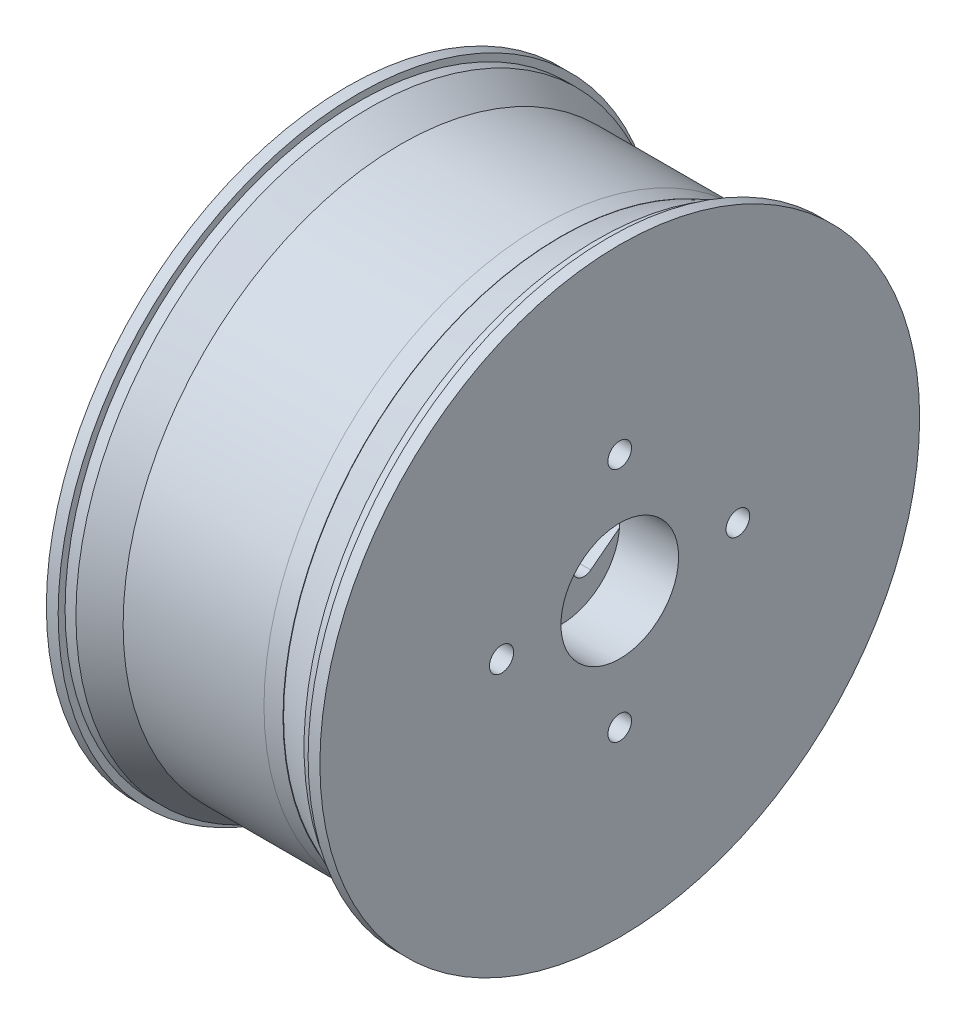
from build123d import *

# Parameters (mm, degrees)
CROQUIS2_R                 = 5
CORTAR_EXTRUIR1_DEPTH      = 225.951634778
ESCALA1_SCALE              = 0.8
CORTAR_EXTRUIR2_DEPTH      = 255
CORTAR_EXTRUIR2_DEPTH_BACK = 175
CROQUIS3_W                 = 69.878792472
CROQUIS3_H                 = 224.605431487
CROQUIS5_R                 = 101.510629677
CORTAR_EXTRUIR3_DEPTH      = 1.8
CROQUIS6_R                 = 19.91659092
CORTAR_EXTRUIR4_DEPTH      = 123
CROQUIS7_R                 = 4
CROQUIS7_R_2               = 4.0947051
CORTAR_EXTRUIR5_DEPTH      = 123


with BuildPart() as part:
    # Croquis1 → Revolución1 (revolve)
    with BuildSketch(Plane(origin=(0, 0, 0), x_dir=(1, 0, 0), z_dir=(0, 1, 0)), mode=Mode.PRIVATE) as revoluci_n1_sk:
        Polygon((-84.492307697, 126.907004271), (-84.492307697, 121.907004271), (-77.199679771, 118.257622684), (-61.599944947, 112.544039646), (-54.839043525, 112.544039646), (-54.839043525, 24.920091933), (-36.545776531, 24.920091933), (-36.545776531, 112.544088846), (57.615236657, 112.544088846), (73.214966765, 118.25768476), (80.50759168, 121.907072367), (80.507587553, 126.907072367), (75.507587548, 126.912704348), (75.507589968, 123.980963434), (70.922334115, 123.980959649), (57.615232714, 117.321797618), (-1.992356117, 117.321748418), (-61.599944947, 117.321748418), (-74.907051844, 123.980899465), (-79.492307697, 123.980899465), (-79.492307697, 126.912640379), align=None)
    revolve(revoluci_n1_sk.sketch.rotate(Axis((-84.492307697, 0, 0.092995729), (1, 0, 0)), 180), axis=Axis((-84.492307697, 0, 0.092995729), (1, 0, 0)))

    # Croquis2 → Cortar-Extruir1 (cut, through all)
    with BuildSketch(Plane.ZY.offset(54.839043525)):
        with BuildLine():
            ThreePointArc((30.528582788, -45.440133008), (25.150332276, -46.880047701), (24.664698483, -52.426496358))
            Line((24.664698483, -52.426496358), (34.516411599, -69.490164015))
            ThreePointArc((34.516411599, -69.490164015), (38.954270135, -71.910965134), (43.137091963, -69.072150594))
            Line((43.137091963, -69.072150594), (53.742727711, -55.310992442))
            ThreePointArc((53.742727711, -55.310992442), (54.305907236, -50.480348559), (50.307859812, -47.711249735))
            Line((50.307859812, -47.711249735), (30.528582788, -45.440133008))
        make_face()
        with BuildLine():
            ThreePointArc((45.440133008, 30.528582788), (46.880047701, 25.150332276), (52.426496358, 24.664698483))
            Line((52.426496358, 24.664698483), (69.490164015, 34.516411599))
            ThreePointArc((69.490164015, 34.516411599), (71.910965134, 38.954270135), (69.072150594, 43.137091963))
            Line((69.072150594, 43.137091963), (55.310992442, 53.742727711))
            ThreePointArc((55.310992442, 53.742727711), (50.480348559, 54.305907236), (47.711249735, 50.307859812))
            Line((47.711249735, 50.307859812), (45.440133008, 30.528582788))
        make_face()
        with BuildLine():
            ThreePointArc((-45.440133008, -30.528582788), (-46.880047701, -25.150332276), (-52.426496358, -24.664698483))
            Line((-52.426496358, -24.664698483), (-69.490164015, -34.516411599))
            ThreePointArc((-69.490164015, -34.516411599), (-71.910965134, -38.954270135), (-69.072150594, -43.137091963))
            Line((-69.072150594, -43.137091963), (-55.310992442, -53.742727711))
            ThreePointArc((-55.310992442, -53.742727711), (-50.480348559, -54.305907236), (-47.711249735, -50.307859812))
            Line((-47.711249735, -50.307859812), (-45.440133008, -30.528582788))
        make_face()
        with BuildLine():
            ThreePointArc((-30.528582788, 45.440133008), (-25.150332276, 46.880047701), (-24.664698483, 52.426496358))
            Line((-24.664698483, 52.426496358), (-34.516411599, 69.490164015))
            ThreePointArc((-34.516411599, 69.490164015), (-38.954270135, 71.910965134), (-43.137091963, 69.072150594))
            Line((-43.137091963, 69.072150594), (-53.742727711, 55.310992442))
            ThreePointArc((-53.742727711, 55.310992442), (-54.305907236, 50.480348559), (-50.307859812, 47.711249735))
            Line((-50.307859812, 47.711249735), (-30.528582788, 45.440133008))
        make_face()
        with BuildLine():
            Line((-100.841208128, 17.107848943), (-102.748469547, 0.497407258))
            ThreePointArc((-102.748469547, 0.497407258), (-98.913930395, -4.33194641), (-94.084576727, -0.497407258))
            Line((-94.084576727, -0.497407258), (-92.177315309, 16.113034427))
            ThreePointArc((-92.177315309, 16.113034427), (-96.011854461, 20.942388095), (-100.841208128, 17.107848943))
        make_face()
        with BuildLine():
            Line((17.107848943, 100.841208128), (0.497407258, 102.748469547))
            ThreePointArc((0.497407258, 102.748469547), (-4.33194641, 98.913930395), (-0.497407258, 94.084576727))
            Line((-0.497407258, 94.084576727), (16.113034427, 92.177315309))
            ThreePointArc((16.113034427, 92.177315309), (20.942388095, 96.011854461), (17.107848943, 100.841208128))
        make_face()
        with BuildLine():
            Line((100.841208128, -17.107848943), (102.748469547, -0.497407258))
            ThreePointArc((102.748469547, -0.497407258), (98.913930395, 4.33194641), (94.084576727, 0.497407258))
            Line((94.084576727, 0.497407258), (92.177315309, -16.113034427))
            ThreePointArc((92.177315309, -16.113034427), (96.011854461, -20.942388095), (100.841208128, -17.107848943))
        make_face()
        with BuildLine():
            Line((-17.107848943, -100.841208128), (-0.497407258, -102.748469547))
            ThreePointArc((-0.497407258, -102.748469547), (4.33194641, -98.913930395), (0.497407258, -94.084576727))
            Line((0.497407258, -94.084576727), (-16.113034427, -92.177315309))
            ThreePointArc((-16.113034427, -92.177315309), (-20.942388095, -96.011854461), (-17.107848943, -100.841208128))
        make_face()
        with Locations((50, 0)):
            Circle(CROQUIS2_R)
        with Locations((0, -50)):
            Circle(CROQUIS2_R)
        with Locations((-50, 0)):
            Circle(CROQUIS2_R)
        with Locations((0, 50)):
            Circle(CROQUIS2_R)
    extrude(amount=-CORTAR_EXTRUIR1_DEPTH, mode=Mode.SUBTRACT)


with BuildPart() as part_1:
    # Escala1: scaled about (-24.23364214, 0, 0.097415806)
    add(part.part.scale(ESCALA1_SCALE).moved(Location((-4.846728428, 0, 0.019483161))))

    # Croquis3 → Cortar-Extruir2 (cut, two sides: drawn at the far end of the back side and taken through both)
    with BuildSketch(Plane(origin=(0, 0, 0), x_dir=(1, 0, 0), z_dir=(0, 1, 0)).offset(-CORTAR_EXTRUIR2_DEPTH_BACK)):
        with Locations((34.939396236, -6.332918973)):
            Rectangle(CROQUIS3_W, CROQUIS3_H)
    extrude(amount=CORTAR_EXTRUIR2_DEPTH + CORTAR_EXTRUIR2_DEPTH_BACK, mode=Mode.SUBTRACT)

    # Croquis4 → Revolución3 (revolve)
    with BuildSketch(Plane(origin=(0, 0, 0), x_dir=(1, 0, 0), z_dir=(0, 1, 0))):
        Polygon((0, 93.837921424), (12.264709329, 99.165236946), (15.983101642, 99.165236946), (15.983101642, 101.510629677), (21.767267462, 101.510629677), (21.767267462, 0), (0, 0), align=None)
    revolve(axis=Axis((21.767267462, 0, 0), (-1, 0, 0)))

    # Croquis5 → Cortar-Extruir3 (cut)
    with BuildSketch(Plane(origin=(21.767267462, 0, 0), x_dir=(0, 0, -1), z_dir=(1, 0, 0))):
        Circle(CROQUIS5_R)
    extrude(amount=-CORTAR_EXTRUIR3_DEPTH, mode=Mode.SUBTRACT)

    # Croquis6 → Cortar-Extruir4 (cut)
    with BuildSketch(Plane.ZY.offset(48.717972584)):
        with Locations(Location((0, 0, 0), (0, 0, 180))):
            Circle(CROQUIS6_R)
    extrude(amount=-CORTAR_EXTRUIR4_DEPTH, mode=Mode.SUBTRACT)

    # Croquis7 → Cortar-Extruir5 (cut)
    with BuildSketch(Plane.ZY.offset(48.717972584)):
        with Locations((0.019482626, 40)):
            Circle(CROQUIS7_R)
        with Locations(Location((40.019482626, 0, 0), (0, 0, 180))):
            Circle(CROQUIS7_R_2)
        with Locations((-39.980517374, 0)):
            Circle(CROQUIS7_R)
        with Locations((0.019482626, -40)):
            Circle(CROQUIS7_R)
    extrude(amount=-CORTAR_EXTRUIR5_DEPTH, mode=Mode.SUBTRACT)


solid = part_1.part
